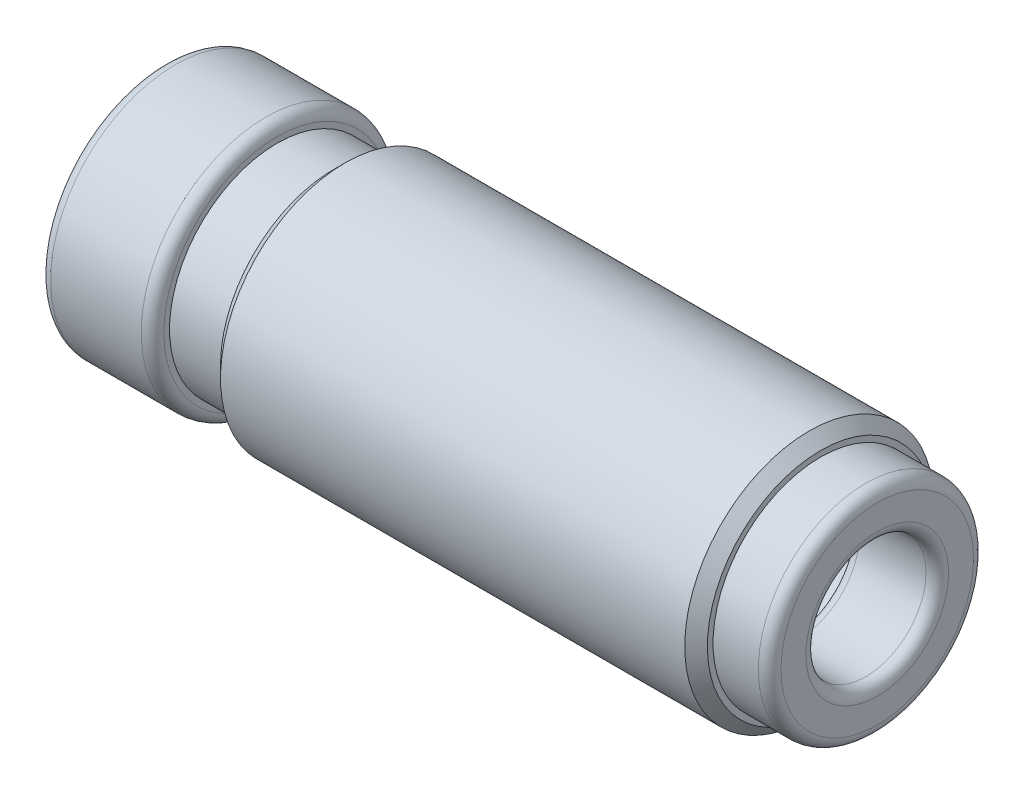
from build123d import *

# Parameters (mm, degrees)
FURO_ROSCADO_DE_M14X1_51_D           = 12.5
FURO_ROSCADO_DE_M14X1_51_DEPTH       = 55
FURO_ROSCADO_DE_M14X1_51_CSINK_D     = 14.05
FURO_ROSCADO_DE_M14X1_51_CSINK_ANGLE = 90
FURO_ROSCADO_DE_M14X1_51_TIP         = 3.755378869
FURO1_D                              = 10.6
FURO1_DEPTH                          = 8
FILETE1_R                            = 1
CHANFRO1_SIZE                        = 1


with BuildPart() as part:
    # Esboço1 → Revolução1 (revolve)
    with BuildSketch(Plane.XY):
        Polygon((0, 0), (0, 11), (10, 11), (10.001583267, 9.5), (15.001583267, 9.5), (15.001583267, 11), (58, 11), (58, 9.5), (63, 9.5), (63, 0), align=None)
    revolve(axis=Axis((63, 0, 0), (-1, 0, 0)))

    # Furo roscado de M14x1.51
    with Locations(Plane.ZY):
        with Locations((0, 0)):
            CounterSinkHole(FURO_ROSCADO_DE_M14X1_51_D / 2, FURO_ROSCADO_DE_M14X1_51_CSINK_D / 2, depth=FURO_ROSCADO_DE_M14X1_51_DEPTH, counter_sink_angle=FURO_ROSCADO_DE_M14X1_51_CSINK_ANGLE)
            with Locations((0, 0, -(FURO_ROSCADO_DE_M14X1_51_DEPTH + FURO_ROSCADO_DE_M14X1_51_TIP / 2))):  # 118° drill point
                Cone(0, FURO_ROSCADO_DE_M14X1_51_D / 2, FURO_ROSCADO_DE_M14X1_51_TIP, mode=Mode.SUBTRACT)

    # Furo1
    with Locations(Plane(origin=(63, 0, 0), x_dir=(0, 0, -1), z_dir=(1, 0, 0))):
        with Locations((0, 0)):
            Hole(FURO1_D / 2, depth=FURO1_DEPTH)

    # Filete1
    filete1_edges = [part.edges().sort_by_distance(p)[0] for p in [
        (10, -11, 0),
        (0, -11, 0),
        (55.570817588, 0, -5.3),
        (63, 0, -5.3),
        (63, -9.5, 0),
    ]]
    fillet(filete1_edges, radius=FILETE1_R)

    # Chanfro1
    chanfro1_edges = [part.edges().sort_by_distance(p)[0] for p in [
        (58, -11, 0),
        (15.001583267, -11, 0),
    ]]
    chamfer(chanfro1_edges, length=CHANFRO1_SIZE)


solid = part.part
